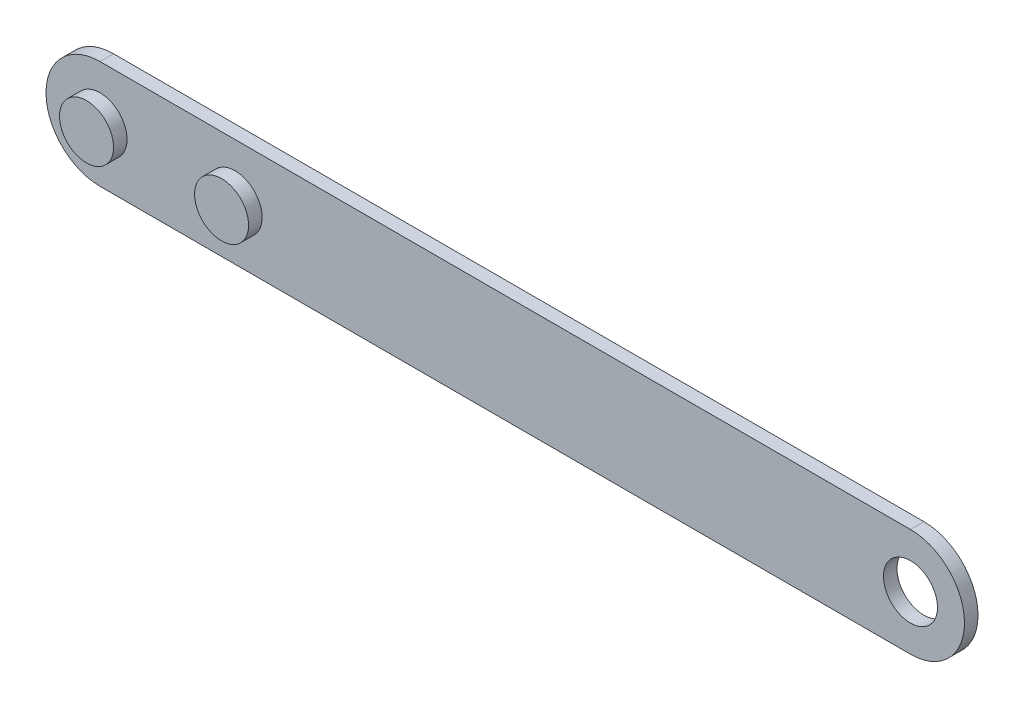
from build123d import *

# Parameters (mm, degrees)
SKETCH_1_R      = 10
EXTRUDE_1_DEPTH = 5
SKETCH_2_R      = 10
EXTRUDE_2_DEPTH = 5


with BuildPart() as part:
    # 草图1 → 凸台-拉伸1 (new body)
    with BuildSketch(Plane.XY):
        with BuildLine():
            Line((0, 20), (300, 20))
            ThreePointArc((300, 20), (320, 0), (300, -20))
            Line((300, -20), (0, -20))
            ThreePointArc((0, -20), (-20, 0), (0, 20))
        make_face()
        with Locations((300, 0)):
            Circle(SKETCH_1_R, mode=Mode.SUBTRACT)
    extrude(amount=EXTRUDE_1_DEPTH)

    # 草图2 → 凸台-拉伸2 (add)
    with BuildSketch(Plane.XY.offset(5)):
        Circle(SKETCH_2_R)
        with Locations((50, 0)):
            Circle(SKETCH_2_R)
    extrude(amount=EXTRUDE_2_DEPTH)


solid = part.part
